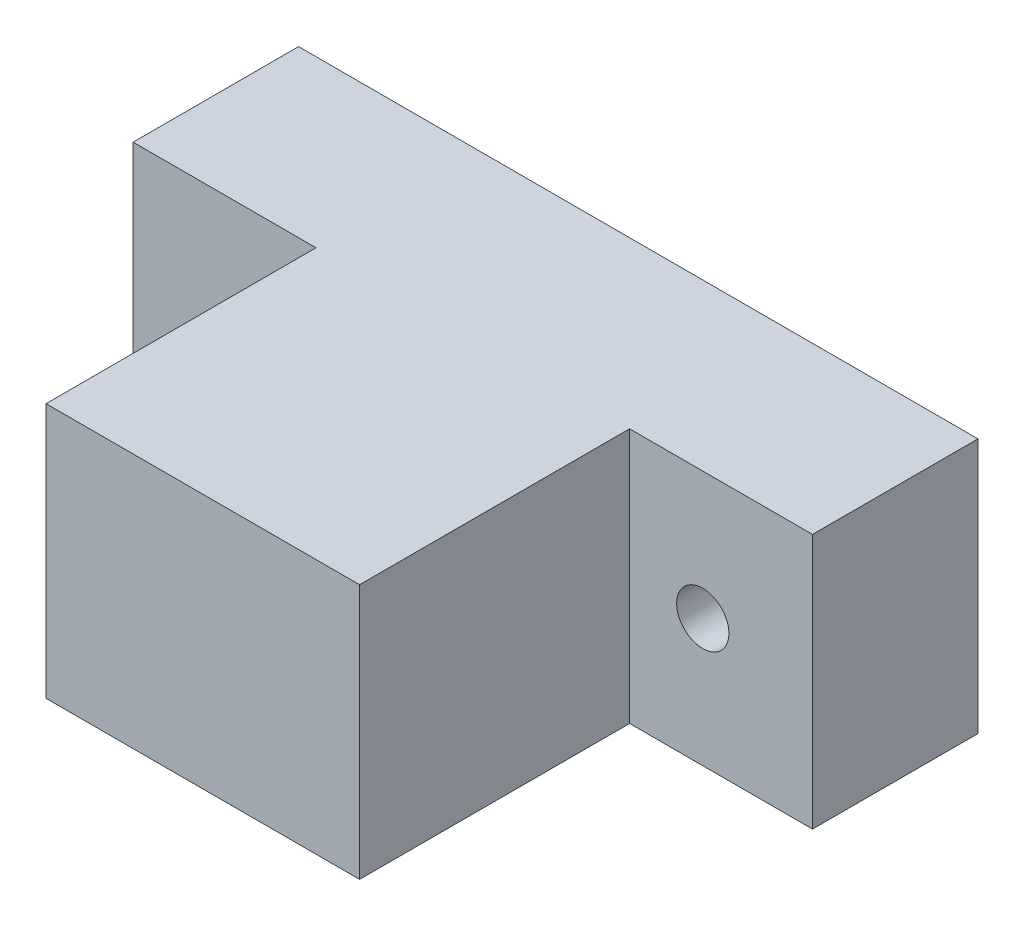
from build123d import *

# Parameters (mm, degrees)
SKETCH1_W           = 39
SKETCH1_H           = 14.65
BOSS_EXTRUDE1_DEPTH = 9.5
SKETCH2_W           = 18
SKETCH2_H           = 14.65
BOSS_EXTRUDE2_DEPTH = 15.5
SKETCH3_R           = 1.5
CUT_EXTRUDE1_DEPTH  = 15.5


with BuildPart() as part:
    # Sketch1 → Boss-Extrude1 (new body)
    with BuildSketch(Plane.XY):
        with Locations((19.5, 7.325)):
            Rectangle(SKETCH1_W, SKETCH1_H)
    extrude(amount=BOSS_EXTRUDE1_DEPTH)

    # Sketch2 → Boss-Extrude2 (add)
    with BuildSketch(Plane.XY.offset(9.5)):
        with Locations((19.5, 7.325)):
            Rectangle(SKETCH2_W, SKETCH2_H)
    extrude(amount=BOSS_EXTRUDE2_DEPTH)

    # Sketch3 → Cut-Extrude1 (cut)
    with BuildSketch(Plane(origin=(0, 0, 0), x_dir=(-1, 0, 0), z_dir=(0, 0, -1))):
        with Locations((-32.7, 7.325)):
            Circle(SKETCH3_R)
        with Locations((-6.3, 7.325)):
            Circle(SKETCH3_R)
    extrude(amount=-CUT_EXTRUDE1_DEPTH, mode=Mode.SUBTRACT)


solid = part.part
